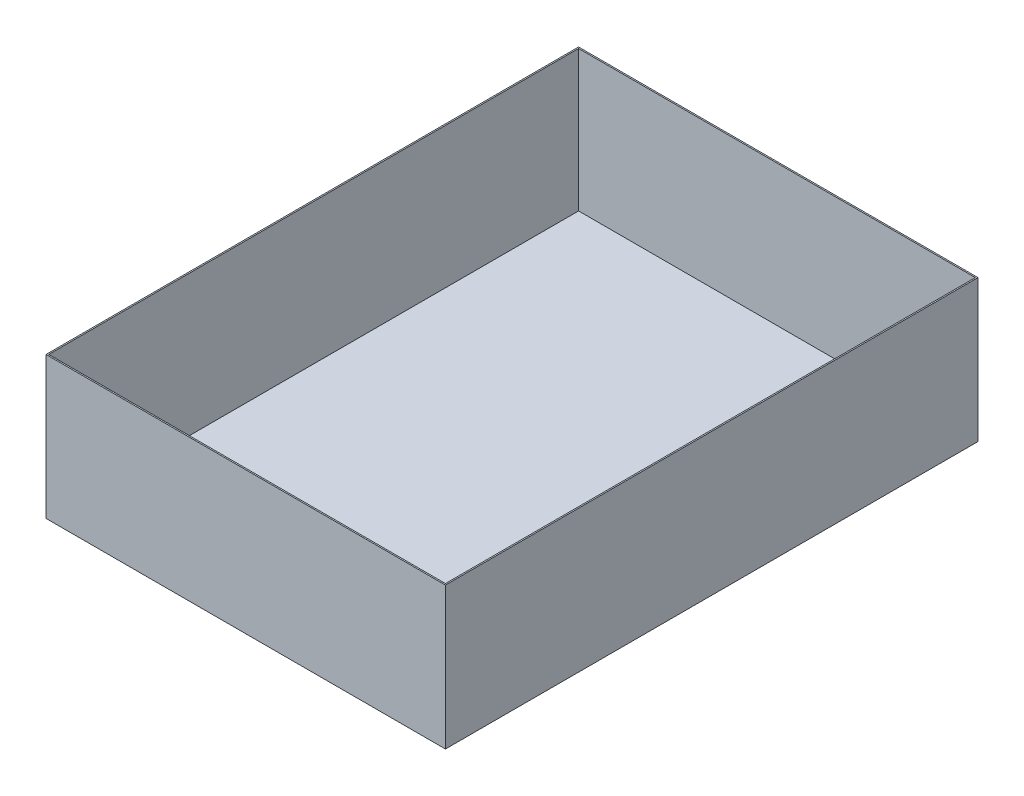
from build123d import *

# Parameters (mm, degrees)
SKETCH1_W           = 450
SKETCH1_H           = 600
BOSS_EXTRUDE1_DEPTH = 160
SKETCH2_W           = 447
SKETCH2_H           = 597
CUT_EXTRUDE1_DEPTH  = 158.5


with BuildPart() as part:
    # Sketch1 → Boss-Extrude1 (new body)
    with BuildSketch(Plane(origin=(0, 0, 0), x_dir=(1, 0, 0), z_dir=(0, 1, 0))):
        with Locations((225, 300)):
            Rectangle(SKETCH1_W, SKETCH1_H)
    extrude(amount=BOSS_EXTRUDE1_DEPTH)

    # Sketch2 → Cut-Extrude1 (cut)
    with BuildSketch(Plane(origin=(0, 160, 0), x_dir=(1, 0, 0), z_dir=(0, 1, 0))):
        with Locations((225, 300)):
            Rectangle(SKETCH2_W, SKETCH2_H)
    extrude(amount=-CUT_EXTRUDE1_DEPTH, mode=Mode.SUBTRACT)


solid = part.part
